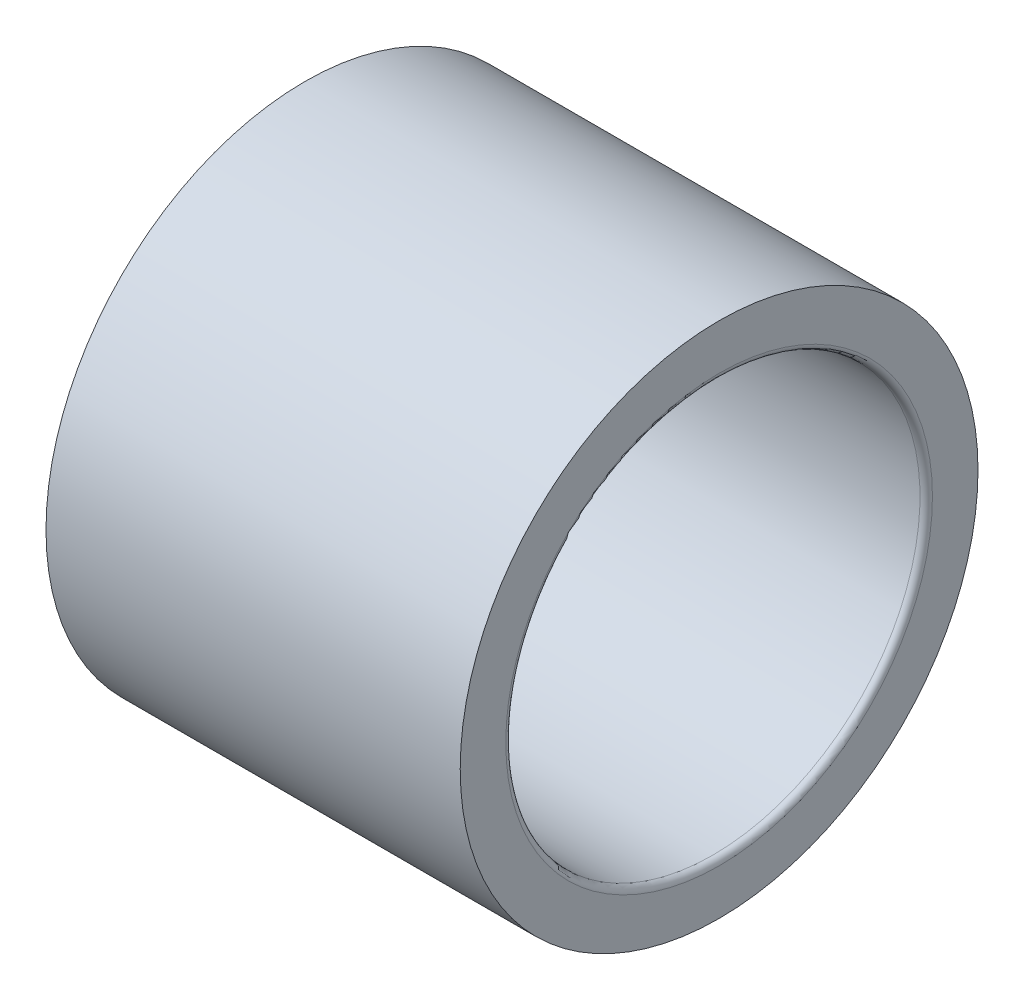
from build123d import *


with BuildPart() as part:
    # Sketch1 → Revolve1 (revolve)
    with BuildSketch(Plane.XY, mode=Mode.PRIVATE) as revolve1_sk:
        with BuildLine():
            Line((0.3, 10), (19.7, 10))
            ThreePointArc((19.7, 10), (19.912132034, 10.087867966), (20, 10.3))
            Line((20, 10.3), (20, 12.5))
            Line((20, 12.5), (0, 12.5))
            Line((0, 12.5), (0, 10.3))
            ThreePointArc((0, 10.3), (0.087867966, 10.087867966), (0.3, 10))
        make_face()
    revolve(revolve1_sk.sketch.rotate(Axis((0, 0, 0), (1, 0, 0)), 180), axis=Axis((0, 0, 0), (1, 0, 0)))


solid = part.part
